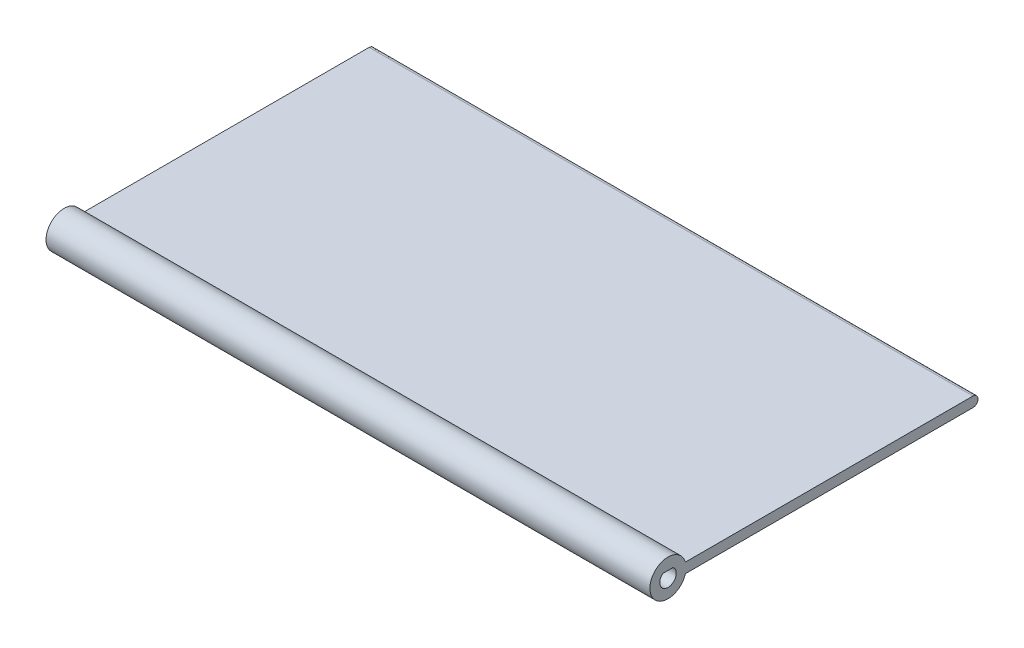
from build123d import *

# Parameters (mm, degrees)
SKETCH1_R               = 9
BOSS_EXTRUDE1_DEPTH     = 300
CUT_EXTRUDE1_DEPTH      = 301.269878609
CUT_EXTRUDE1_DEPTH_BACK = 301.269878609
SKETCH3_W               = 149.9
SKETCH3_H               = 5
BOSS_EXTRUDE2_DEPTH     = 300
CUT_EXTRUDE2_DEPTH      = 338.338109321
CUT_EXTRUDE2_DEPTH_BACK = 338.338109321


with BuildPart() as part:
    # Sketch1 → Boss-Extrude1 (new body)
    with BuildSketch(Plane(origin=(0, 0, 0), x_dir=(0, 0, -1), z_dir=(1, 0, 0))):
        Circle(SKETCH1_R)
    extrude(amount=BOSS_EXTRUDE1_DEPTH)

    # Sketch2 → Cut-Extrude1 (cut, two sides: drawn at the far end of the back side and taken through both)
    with BuildSketch(Plane(origin=(300, 0, 0), x_dir=(0, 0, -1), z_dir=(1, 0, 0)).offset(-CUT_EXTRUDE1_DEPTH_BACK)):
        with BuildLine():
            Line((-2.563201124, 3.2), (2.563201124, 3.2))
            ThreePointArc((2.563201124, 3.2), (0, -4.1), (-2.563201124, 3.2))
        make_face()
    extrude(amount=CUT_EXTRUDE1_DEPTH + CUT_EXTRUDE1_DEPTH_BACK, mode=Mode.SUBTRACT)

    # Sketch3 → Boss-Extrude2 (add)
    with BuildSketch(Plane(origin=(300, 0, 0), x_dir=(0, 0, -1), z_dir=(1, 0, 0))):
        with Locations((79.05, 0)):
            Rectangle(SKETCH3_W, SKETCH3_H)
    extrude(amount=-BOSS_EXTRUDE2_DEPTH)

    # Sketch4 → Cut-Extrude2 (cut, two sides: drawn at the far end of the back side and taken through both)
    with BuildSketch(Plane(origin=(300, 0, 0), x_dir=(0, 0, -1), z_dir=(1, 0, 0)).offset(-CUT_EXTRUDE2_DEPTH_BACK)):
        with BuildLine():
            Line((154, 2.5), (151.5, 2.5))
            ThreePointArc((151.5, 2.5), (153.267766953, 1.767766953), (154, 0))
            Line((154, 0), (154, 2.5))
        make_face()
        with BuildLine():
            Line((154, -2.5), (154, 0))
            ThreePointArc((154, 0), (153.267766953, -1.767766953), (151.5, -2.5))
            Line((151.5, -2.5), (154, -2.5))
        make_face()
    extrude(amount=CUT_EXTRUDE2_DEPTH + CUT_EXTRUDE2_DEPTH_BACK, mode=Mode.SUBTRACT)


solid = part.part
